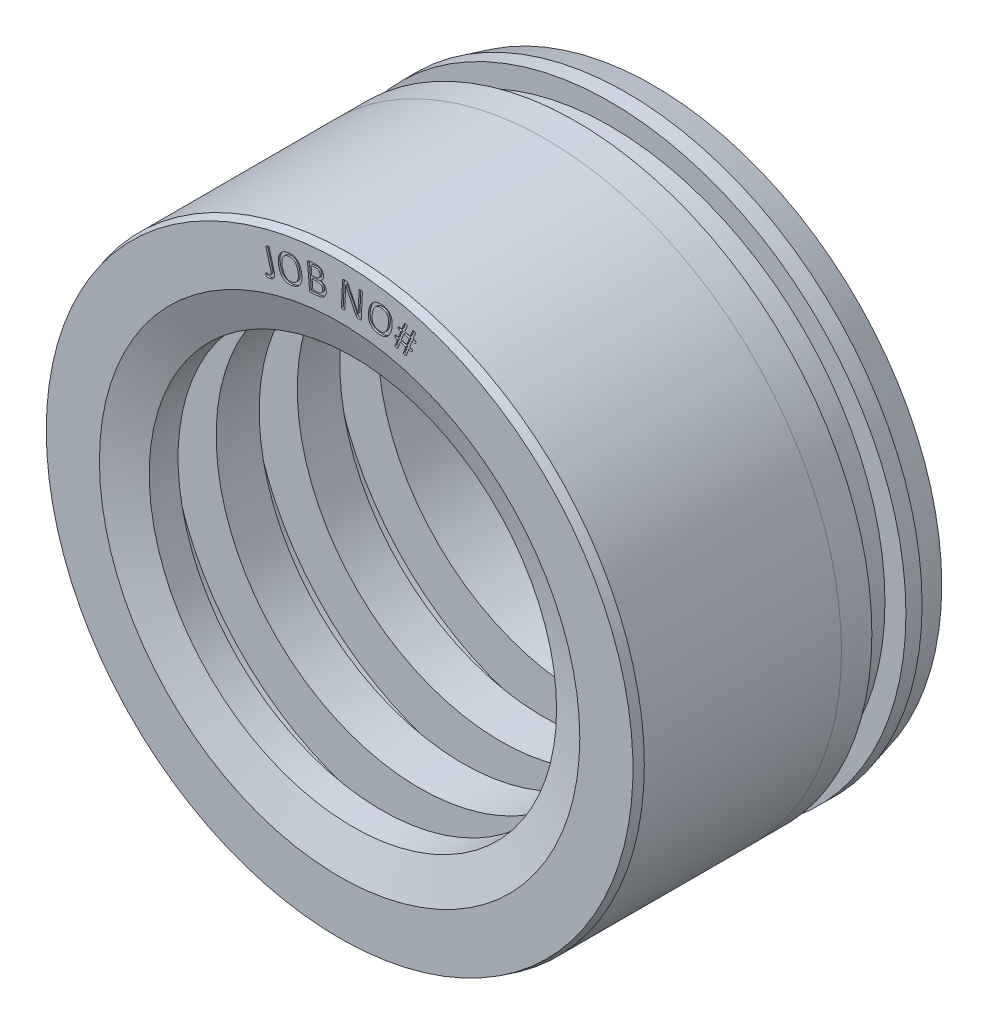
from build123d import *

# Parameters (mm, degrees)
CHAMFER1_SIZE      = 1
CHAMFER1_SIZE2     = 0.267949192
CUT_EXTRUDE1_DEPTH = 0.2


with BuildPart() as part:
    # Sketch1 → Revolve1 (revolve)
    with BuildSketch(Plane(origin=(0, 0, 0), x_dir=(0, 0, -1), z_dir=(1, 0, 0)), mode=Mode.PRIVATE) as revolve1_sk:
        Polygon((35, 32.186152423), (32, 32.99), (30.2, 32.99), (30.2, 30.65), (26.4, 30.65), (26.4, 32.99), (23, 32.99), (23, 33), (0, 33), (0, 26.8), (1.483178705, 22.725), (4.7, 22.725), (4.7, 27.95), (8.95, 27.95), (8.95, 22.725), (13.75, 22.725), (13.75, 27.95), (18, 27.95), (18, 22.725), (22.75, 22.725), (22.75, 27.95), (27, 27.95), (27, 22.725), (34, 22.725), (35, 24.457050808), align=None)
    revolve(revolve1_sk.sketch.rotate(Axis((0, 0, 0), (0, 0, -1)), 90), axis=Axis((0, 0, 0), (0, 0, -1)))

    # Chamfer1
    chamfer1_edges = [part.edges().sort_by_distance(p)[0] for p in [
        (-33, 0, 0),
    ]]
    chamfer1_side = [part.faces().sort_by_distance(p)[0] for p in [
        (-33, 0, -11.5),
    ]]
    chamfer(chamfer1_edges, length=CHAMFER1_SIZE, length2=CHAMFER1_SIZE2, reference=chamfer1_side[0])

    # Sketch2 → Cut-Extrude1 (cut)
    # profile 1 of 6: a face of its own
    with BuildSketch(Plane.XY):
        with BuildLine():
            add(Edge.make_bspline(
                [(8.501678764, 29.048994832), (8.498549681, 29.03756519), (8.492753583, 29.016393708), (8.481651699, 28.987903351), (8.46849952, 28.965577247), (8.4557374, 28.947427815), (8.440343664, 28.935703416), (8.424547967, 28.92855662), (8.40821196, 28.926457588), (8.397779108, 28.92835772), (8.392671889, 28.929287896)],
                knots=[0, 0, 0, 0, 1.577359455, 2.921792161, 4.051662468, 5.024971448, 5.849934203, 6.594100363, 7.31176662, 8, 8, 8, 8], degree=3))
            Line((8.392671889, 28.929287896), (8.105107743, 29.002850817))
            Line((8.105107743, 29.002850817), (7.831587426, 28.296646773))
            Line((7.831587426, 28.296646773), (8.085713882, 28.231777652))
            add(Edge.make_bspline(
                [(8.085713882, 28.231777652), (8.095930094, 28.227391442), (8.117305676, 28.218214087), (8.130661319, 28.189522189), (8.13712975, 28.162799785), (8.136032434, 28.136680174), (8.133021582, 28.10593828), (8.127508805, 28.084376252), (8.124501604, 28.07261424)],
                knots=[0, 0, 0, 0, 1.06858838, 2.235828552, 2.937870731, 3.799394226, 4.799577181, 6, 6, 6, 6], degree=3))
            add(Edge.make_bspline(
                [(8.124501604, 28.07261424), (8.121497998, 28.06113345), (8.115889821, 28.039697111), (8.103239283, 28.011727446), (8.089233167, 27.989754244), (8.076315896, 27.972338553), (8.062478156, 27.958672932), (8.046127569, 27.952389747), (8.029723415, 27.950033816), (8.019273026, 27.951962938), (8.014157222, 27.952907305)],
                knots=[0, 0, 0, 0, 1.574619005, 2.940047235, 4.05779653, 5.029414517, 5.826415199, 6.596542924, 7.312962333, 8, 8, 8, 8], degree=3))
            Line((8.014157222, 27.952907305), (7.722580552, 28.02713898))
            Line((7.722580552, 28.02713898), (7.439028928, 27.300203567))
            add(Edge.make_bspline(
                [(7.439028928, 27.300203567), (7.436951428, 27.295674235), (7.432755283, 27.286525873), (7.423803663, 27.274280204), (7.410295919, 27.265702561), (7.392878027, 27.260050843), (7.369846988, 27.260755812), (7.340701098, 27.262214235), (7.303753538, 27.270067393), (7.276494597, 27.276511289), (7.26114041, 27.280140952)],
                knots=[0, 0, 0, 0, 0.60656633, 1.225145041, 1.811980333, 2.524017901, 3.419602356, 4.588875977, 6.078610788, 8, 8, 8, 8], degree=3))
            add(Edge.make_bspline(
                [(7.26114041, 27.280140952), (7.245954002, 27.284265309), (7.218320155, 27.291770168), (7.181234682, 27.303440164), (7.15276853, 27.315417931), (7.131617946, 27.327120595), (7.118227123, 27.34021447), (7.110180644, 27.353916815), (7.109893726, 27.369027826), (7.113044146, 27.378303089), (7.114683321, 27.383129042)],
                knots=[0, 0, 0, 0, 1.874516537, 3.410951809, 4.62412259, 5.552976479, 6.266363648, 6.836406045, 7.394577765, 8, 8, 8, 8], degree=3))
            Line((7.114683321, 27.383129042), (7.397566191, 28.110064455))
            Line((7.397566191, 28.110064455), (6.787662698, 28.265884097))
            Line((6.787662698, 28.265884097), (6.504111074, 27.538948684))
            add(Edge.make_bspline(
                [(6.504111074, 27.538948684), (6.501470109, 27.534479476), (6.496315019, 27.525755708), (6.488164529, 27.513113498), (6.475662697, 27.503597411), (6.458590089, 27.498394105), (6.436270613, 27.497627899), (6.407608436, 27.500821519), (6.371040996, 27.507890683), (6.344023611, 27.5145109), (6.328897571, 27.518217316)],
                knots=[0, 0, 0, 0, 0.64064477, 1.250520422, 1.838348835, 2.533225652, 3.413898066, 4.572749697, 6.081208675, 8, 8, 8, 8], degree=3))
            add(Edge.make_bspline(
                [(6.328897571, 27.518217316), (6.313040308, 27.522319889), (6.284492246, 27.529705812), (6.246479161, 27.541380416), (6.217911333, 27.553562836), (6.196689586, 27.564961571), (6.183759178, 27.578605938), (6.175991434, 27.592502452), (6.17576988, 27.607669861), (6.178402652, 27.617029357), (6.179765467, 27.621874159)],
                knots=[0, 0, 0, 0, 1.927076015, 3.469343156, 4.667425873, 5.584727714, 6.270953198, 6.857235194, 7.408464998, 8, 8, 8, 8], degree=3))
            Line((6.179765467, 27.621874159), (6.460642076, 28.348809572))
            Line((6.460642076, 28.348809572), (6.20651562, 28.413678694))
            add(Edge.make_bspline(
                [(6.20651562, 28.413678694), (6.196415693, 28.418118016), (6.175358749, 28.427373386), (6.160334905, 28.455120116), (6.155418807, 28.482115409), (6.156068966, 28.508084226), (6.159317598, 28.538571375), (6.164344583, 28.559956613), (6.167059144, 28.571504597)],
                knots=[0, 0, 0, 0, 1.075545008, 2.242361686, 2.944412003, 3.81154411, 4.818238366, 6, 6, 6, 6], degree=3))
            add(Edge.make_bspline(
                [(6.167059144, 28.571504597), (6.170328125, 28.582975601), (6.176416376, 28.604339554), (6.189163334, 28.632509153), (6.202693703, 28.654600092), (6.215395701, 28.672127455), (6.229019854, 28.684899038), (6.244300738, 28.69263808), (6.261136058, 28.695534969), (6.272291292, 28.693568253), (6.27807228, 28.692549041)],
                knots=[0, 0, 0, 0, 1.574723399, 2.932813638, 4.069646214, 4.99474395, 5.787461446, 6.512109029, 7.228928864, 8, 8, 8, 8], degree=3))
            Line((6.27807228, 28.692549041), (6.571655211, 28.617648612))
            Line((6.571655211, 28.617648612), (6.847850543, 29.323183902))
            Line((6.847850543, 29.323183902), (6.582355273, 29.390728039))
            add(Edge.make_bspline(
                [(6.582355273, 29.390728039), (6.572457875, 29.395199612), (6.551448372, 29.404691555), (6.537185229, 29.432998777), (6.531042469, 29.459972124), (6.532139948, 29.485553825), (6.534224325, 29.51500743), (6.539414638, 29.535455786), (6.542230043, 29.546547681)],
                knots=[0, 0, 0, 0, 1.07166923, 2.274864503, 3.013780115, 3.870973041, 4.845142253, 6, 6, 6, 6], degree=3))
            add(Edge.make_bspline(
                [(6.542230043, 29.546547681), (6.54527547, 29.558463042), (6.550949315, 29.580662205), (6.563062371, 29.609840067), (6.575542575, 29.633510844), (6.593315921, 29.654691498), (6.619210274, 29.673557515), (6.642279558, 29.67087381), (6.653243178, 29.669598386)],
                knots=[0, 0, 0, 0, 1.200825084, 2.237222169, 3.086333729, 3.798121571, 4.953562727, 6, 6, 6, 6], degree=3))
            Line((6.653243178, 29.669598386), (6.951507387, 29.593360449))
            Line((6.951507387, 29.593360449), (7.22101518, 30.274820602))
            add(Edge.make_bspline(
                [(7.22101518, 30.274820602), (7.223320091, 30.279357896), (7.227848855, 30.288272922), (7.237515083, 30.300679834), (7.252132102, 30.309404688), (7.271573618, 30.313863847), (7.295945177, 30.314745171), (7.326854445, 30.312443317), (7.365322887, 30.306182184), (7.393379514, 30.299343536), (7.408935006, 30.29555197)],
                knots=[0, 0, 0, 0, 0.592664552, 1.164486684, 1.805777482, 2.530013117, 3.466198308, 4.637221686, 6.135568013, 8, 8, 8, 8], degree=3))
            add(Edge.make_bspline(
                [(7.408935006, 30.29555197), (7.424627817, 30.291364131), (7.452254409, 30.283991602), (7.488040635, 30.270790032), (7.514914999, 30.259182603), (7.533578946, 30.246946224), (7.546690912, 30.234765329), (7.551500447, 30.220302634), (7.551049204, 30.206724427), (7.549475885, 30.198119839), (7.548704556, 30.193901388)],
                knots=[0, 0, 0, 0, 2.016994508, 3.550841433, 4.740890769, 5.639934809, 6.325892007, 6.912962093, 7.467073099, 8, 8, 8, 8], degree=3))
            Line((7.548704556, 30.193901388), (7.276521748, 29.511103728))
            Line((7.276521748, 29.511103728), (7.88642524, 29.355284086))
            Line((7.88642524, 29.355284086), (8.151251757, 30.037412992))
            add(Edge.make_bspline(
                [(8.151251757, 30.037412992), (8.153448519, 30.042250371), (8.157808562, 30.051851403), (8.168978515, 30.063594721), (8.183650434, 30.07177528), (8.202446401, 30.076547172), (8.226415563, 30.077305405), (8.257299295, 30.074984701), (8.296515804, 30.068850127), (8.325189321, 30.061547561), (8.341177845, 30.057475607)],
                knots=[0, 0, 0, 0, 0.609823913, 1.210353685, 1.832531076, 2.525167451, 3.426971609, 4.587115257, 6.096955182, 8, 8, 8, 8], degree=3))
            add(Edge.make_bspline(
                [(8.341177845, 30.057475607), (8.356654441, 30.05353307), (8.384306495, 30.046488934), (8.420218788, 30.033261108), (8.447552053, 30.022110608), (8.465957385, 30.009586094), (8.478254561, 29.997129812), (8.482945879, 29.983152115), (8.482917259, 29.969599589), (8.480281216, 29.961354222), (8.478941133, 29.957162532)],
                knots=[0, 0, 0, 0, 1.993008847, 3.560911412, 4.782407199, 5.663029014, 6.333690607, 6.923772937, 7.452879369, 8, 8, 8, 8], degree=3))
            Line((8.478941133, 29.957162532), (8.211439602, 29.272358611))
            Line((8.211439602, 29.272358611), (8.463559795, 29.208158243))
            add(Edge.make_bspline(
                [(8.463559795, 29.208158243), (8.473512171, 29.2037308), (8.494900413, 29.194215963), (8.508257373, 29.164807885), (8.513072196, 29.137516325), (8.513800437, 29.11147173), (8.509122582, 29.081529942), (8.504272292, 29.060330508), (8.501678764, 29.048994832)],
                knots=[0, 0, 0, 0, 1.054796918, 2.266820877, 2.989683893, 3.833673301, 4.841630449, 6, 6, 6, 6], degree=3))
        make_face()
        Polygon((7.170189889, 29.240927181), (6.896669572, 28.534723137), (7.504566804, 28.380241002), (7.782768397, 29.084438785), align=None, mode=Mode.SUBTRACT)
    # profile 2 of 6: a face of its own
    with BuildSketch(Plane.XY):
        with BuildLine():
            add(Edge.make_bspline(
                [(5.841344359, 29.172417648), (5.831674817, 29.11541034), (5.812806858, 29.004173259), (5.771598091, 28.843736559), (5.721496573, 28.693560046), (5.66296085, 28.553578904), (5.595590241, 28.424616276), (5.519073802, 28.307804093), (5.434607113, 28.202299945), (5.340639543, 28.109791646), (5.238280319, 28.029447964), (5.127142548, 27.961775055), (5.006614972, 27.908695236), (4.87818745, 27.867083659), (4.740870929, 27.84165741), (4.595490137, 27.829516327), (4.441732459, 27.832992103), (4.337446996, 27.846624459), (4.283816689, 27.853635096)],
                knots=[0, 0, 0, 0, 1.195743236, 2.33322698, 3.422569482, 4.468326068, 5.468769389, 6.428052817, 7.352796333, 8.259331163, 9.149544344, 10.039279623, 10.943430267, 11.868058793, 12.825844666, 13.825384172, 14.881672389, 16, 16, 16, 16], degree=3))
            add(Edge.make_bspline(
                [(4.283816689, 27.853635096), (4.231235263, 27.862984545), (4.129579992, 27.881059764), (3.984876941, 27.922116842), (3.852921301, 27.97337405), (3.733745028, 28.035697762), (3.627563114, 28.108234291), (3.533239126, 28.189918615), (3.451466678, 28.28129781), (3.38099806, 28.381893592), (3.323242452, 28.4925462), (3.277983898, 28.613062625), (3.244013681, 28.742839186), (3.221255065, 28.881865962), (3.211335881, 29.030245132), (3.211371437, 29.187315937), (3.22294893, 29.353294018), (3.238544914, 29.466078809), (3.2465795, 29.524182162)],
                knots=[0, 0, 0, 0, 1.137963347, 2.200015881, 3.200748308, 4.150928942, 5.060427983, 5.936202435, 6.804440474, 7.667944661, 8.547963664, 9.457921957, 10.406580246, 11.403468906, 12.456456176, 13.573225575, 14.749798351, 16, 16, 16, 16], degree=3))
            add(Edge.make_bspline(
                [(3.2465795, 29.524182162), (3.256059736, 29.579844054), (3.274620552, 29.688821303), (3.314939226, 29.846199501), (3.364608748, 29.993826692), (3.422219342, 30.132050366), (3.490060225, 30.259127322), (3.565131518, 30.375829516), (3.650777889, 30.479377362), (3.74484371, 30.571023958), (3.847678025, 30.650500415), (3.959218134, 30.717072314), (4.07964144, 30.770229176), (4.20835037, 30.810477763), (4.345905265, 30.836298943), (4.491563053, 30.848536076), (4.645508757, 30.843985028), (4.749805195, 30.830503547), (4.803438415, 30.823570853)],
                knots=[0, 0, 0, 0, 1.175170615, 2.30079967, 3.378038498, 4.415856125, 5.4144974, 6.373496265, 7.299902016, 8.205747275, 9.10247536, 9.999491635, 10.903301592, 11.836875559, 12.800791796, 13.811353984, 14.874514468, 16, 16, 16, 16], degree=3))
            add(Edge.make_bspline(
                [(4.803438415, 30.823570853), (4.854897698, 30.814410743), (4.95473482, 30.796639042), (5.097022828, 30.756434434), (5.227202099, 30.70578327), (5.344805172, 30.643718407), (5.451464177, 30.572946673), (5.545695329, 30.491474237), (5.627983906, 30.40039895), (5.698633993, 30.299982038), (5.757842044, 30.190291412), (5.804742684, 30.071031082), (5.839236726, 29.942427016), (5.862468992, 29.804931294), (5.873960527, 29.658614388), (5.875393776, 29.503730259), (5.864349453, 29.340411378), (5.849148526, 29.229407252), (5.841344359, 29.172417648)],
                knots=[0, 0, 0, 0, 1.125000981, 2.182635575, 3.178335119, 4.12739835, 5.040716637, 5.928978647, 6.802434381, 7.677432056, 8.566627468, 9.480311514, 10.430539449, 11.428839112, 12.478864411, 13.587773965, 14.761561271, 16, 16, 16, 16], degree=3))
        make_face()
        with BuildLine():
            add(Edge.make_bspline(
                [(5.432735769, 29.207861601), (5.438473139, 29.248162371), (5.449792341, 29.327671378), (5.45979742, 29.445534151), (5.463133395, 29.560065973), (5.46059977, 29.670582374), (5.45205249, 29.776936655), (5.433752844, 29.877600934), (5.407994191, 29.972540537), (5.37294401, 30.061294895), (5.329793066, 30.144302912), (5.275693283, 30.21985124), (5.211528559, 30.287909574), (5.13728177, 30.348583973), (5.052308577, 30.401232475), (4.955490203, 30.443916097), (4.847093042, 30.477600543), (4.769972778, 30.491387969), (4.729875494, 30.498556492)],
                knots=[0, 0, 0, 0, 1.163836678, 2.296122301, 3.380212619, 4.438644511, 5.456070731, 6.427573492, 7.360088784, 8.264423273, 9.151199722, 10.028533044, 10.912372227, 11.818322723, 12.762916217, 13.761559305, 14.836163322, 16, 16, 16, 16], degree=3))
            add(Edge.make_bspline(
                [(4.729875494, 30.498556492), (4.689596386, 30.503757017), (4.611913465, 30.513786832), (4.49830637, 30.512716337), (4.392385317, 30.500282835), (4.295043138, 30.472184574), (4.205310417, 30.43357901), (4.122395239, 30.386140853), (4.047088372, 30.328365859), (3.977929153, 30.26294223), (3.916239618, 30.188414561), (3.860451767, 30.106603415), (3.811763585, 30.016612749), (3.769853436, 29.919509508), (3.734582739, 29.816758743), (3.702667533, 29.710539917), (3.677384334, 29.600304585), (3.664426629, 29.525361805), (3.657863105, 29.487400701)],
                knots=[0, 0, 0, 0, 1.164650783, 2.246163807, 3.252636931, 4.216927154, 5.142914483, 6.051760683, 6.951527136, 7.861341595, 8.779021547, 9.723292396, 10.699799861, 11.711508199, 12.755842007, 13.816865051, 14.894166811, 16, 16, 16, 16], degree=3))
            add(Edge.make_bspline(
                [(3.657863105, 29.487400701), (3.651897883, 29.44576292), (3.640187437, 29.364022957), (3.629619279, 29.242814662), (3.624843149, 29.125651863), (3.625782584, 29.013099407), (3.633932807, 28.905662153), (3.651461688, 28.804307784), (3.676698988, 28.708783855), (3.71045329, 28.619365687), (3.754492516, 28.53706604), (3.807215449, 28.46135401), (3.871321476, 28.394062792), (3.944482242, 28.333038201), (4.029838237, 28.281196206), (4.127434827, 28.239332754), (4.236827176, 28.205603507), (4.314829109, 28.191828358), (4.355373349, 28.184668241)],
                knots=[0, 0, 0, 0, 1.192429185, 2.340881595, 3.447835165, 4.516056661, 5.530652277, 6.499076176, 7.428152696, 8.328448492, 9.202150189, 10.068413255, 10.935851447, 11.82926556, 12.762567663, 13.755996192, 14.833600316, 16, 16, 16, 16], degree=3))
            add(Edge.make_bspline(
                [(4.355373349, 28.184668241), (4.396093248, 28.179581348), (4.474438128, 28.169794192), (4.589252805, 28.169313351), (4.695776467, 28.183430599), (4.794501859, 28.209918476), (4.884420432, 28.249883812), (4.968329919, 28.297033118), (5.044345987, 28.3551471), (5.112787284, 28.422897404), (5.175051969, 28.498314514), (5.229785093, 28.582149076), (5.279082413, 28.672425375), (5.31984036, 28.77060954), (5.355593476, 28.8739707), (5.387011433, 28.981504581), (5.413511228, 29.093062845), (5.426263318, 29.169211557), (5.432735769, 29.207861601)],
                knots=[0, 0, 0, 0, 1.166421397, 2.244188845, 3.254687502, 4.214409718, 5.140108605, 6.045991596, 6.946266729, 7.851861275, 8.779685267, 9.72216556, 10.695155783, 11.700770128, 12.741368152, 13.804680867, 14.885743708, 16, 16, 16, 16], degree=3))
        make_face(mode=Mode.SUBTRACT)
    # profile 3 of 6: a face of its own
    with BuildSketch(Plane.XY):
        with BuildLine():
            add(Edge.make_bspline(
                [(2.414900928, 28.303990182), (2.413795537, 28.290034958), (2.41171121, 28.263720976), (2.398449602, 28.228300424), (2.380217559, 28.199213139), (2.35689424, 28.177230168), (2.331166837, 28.159643158), (2.30231518, 28.149507265), (2.272687252, 28.143860563), (2.252863674, 28.144059396), (2.243031194, 28.144158017)],
                knots=[0, 0, 0, 0, 1.265186763, 2.385637074, 3.396142155, 4.355069128, 5.275640801, 6.204186777, 7.109278014, 8, 8, 8, 8], degree=3))
            Line((2.243031194, 28.144158017), (2.118642982, 28.150176802))
            add(Edge.make_bspline(
                [(2.118642982, 28.150176802), (2.100316568, 28.15148309), (2.065750747, 28.153946907), (2.016392722, 28.164894529), (1.972663254, 28.186104876), (1.931991954, 28.21645517), (1.894619387, 28.258710724), (1.857121876, 28.312402051), (1.819642553, 28.380386257), (1.794131203, 28.430527655), (1.780253544, 28.457803563)],
                knots=[0, 0, 0, 0, 0.903598151, 1.704294819, 2.469581762, 3.276786746, 4.184965821, 5.231708104, 6.494105142, 8, 8, 8, 8], degree=3))
            Line((1.780253544, 28.457803563), (0.937623718, 30.162457075))
            add(Edge.make_bspline(
                [(0.937623718, 30.162457075), (0.915465003, 30.207665845), (0.870397672, 30.299613349), (0.804090192, 30.439142736), (0.740470757, 30.579707408), (0.700900517, 30.673964111), (0.681491002, 30.720197769)],
                knots=[0, 0, 0, 0, 0.98420471, 2.001717047, 3.019826417, 4, 4, 4, 4], degree=3))
            Line((0.681491002, 30.720197769), (0.676809725, 30.720197769))
            add(Edge.make_bspline(
                [(0.676809725, 30.720197769), (0.675570273, 30.66535724), (0.673065911, 30.554549768), (0.667481392, 30.387595202), (0.661614041, 30.219731552), (0.657025944, 30.107840073), (0.654740848, 30.052112693)],
                knots=[0, 0, 0, 0, 0.984724736, 1.989675538, 2.998760977, 4, 4, 4, 4], degree=3))
            Line((0.654740848, 30.052112693), (0.57114662, 28.289277598))
            add(Edge.make_bspline(
                [(0.57114662, 28.289277598), (0.570562597, 28.28407016), (0.569329582, 28.27307599), (0.561143372, 28.257888213), (0.547502453, 28.244915271), (0.527632687, 28.236600857), (0.502049989, 28.231030572), (0.469666801, 28.226173862), (0.428930915, 28.22456429), (0.399050574, 28.225325714), (0.38255804, 28.225745984)],
                knots=[0, 0, 0, 0, 0.571139017, 1.205813606, 1.846121513, 2.601370287, 3.532966211, 4.719703372, 6.189431547, 8, 8, 8, 8], degree=3))
            add(Edge.make_bspline(
                [(0.38255804, 28.225745984), (0.366048369, 28.226594579), (0.336253607, 28.228126027), (0.296058713, 28.233723396), (0.264964671, 28.242618455), (0.240039473, 28.249358908), (0.222038468, 28.260655243), (0.210042826, 28.27440301), (0.20374112, 28.290338375), (0.203467231, 28.301268857), (0.203332013, 28.306665198)],
                knots=[0, 0, 0, 0, 1.831044974, 3.304460178, 4.478093438, 5.414920516, 6.147687922, 6.795707012, 7.405444794, 8, 8, 8, 8], degree=3))
            Line((0.203332013, 28.306665198), (0.330395241, 31.001743131))
            add(Edge.make_bspline(
                [(0.330395241, 31.001743131), (0.331748841, 31.015622894), (0.334301191, 31.041794586), (0.344344547, 31.077744717), (0.361814328, 31.106794174), (0.384980711, 31.12823982), (0.411425557, 31.143406315), (0.438937981, 31.154139783), (0.467403227, 31.1607481), (0.486627534, 31.160407969), (0.496246191, 31.160237789)],
                knots=[0, 0, 0, 0, 1.289476452, 2.431437729, 3.421963524, 4.385048005, 5.318975301, 6.226797814, 7.112799041, 8, 8, 8, 8], degree=3))
            Line((0.496246191, 31.160237789), (0.681491002, 31.151543989))
            add(Edge.make_bspline(
                [(0.681491002, 31.151543989), (0.701393286, 31.150287783), (0.737940311, 31.147980984), (0.788485423, 31.137229228), (0.831680629, 31.120453497), (0.869147649, 31.095020937), (0.903397, 31.061475518), (0.933792651, 31.016656375), (0.966474129, 30.962564493), (0.9867685, 30.921674076), (0.997811563, 30.899423795)],
                knots=[0, 0, 0, 0, 1.100944121, 2.021689197, 2.845320784, 3.644919334, 4.507441307, 5.478495661, 6.627938179, 8, 8, 8, 8], degree=3))
            Line((0.997811563, 30.899423795), (1.645834024, 29.583985012))
            add(Edge.make_bspline(
                [(1.645834024, 29.583985012), (1.665497365, 29.544328416), (1.704337516, 29.46599645), (1.761061124, 29.349574166), (1.816324637, 29.235967395), (1.868192966, 29.12360608), (1.919853786, 29.013666566), (1.96989233, 28.904621152), (2.02073315, 28.797025199), (2.053012214, 28.724695979), (2.069155198, 28.688523634)],
                knots=[0, 0, 0, 0, 1.072469424, 2.118402676, 3.137824405, 4.133343272, 5.116789259, 6.080988452, 7.040289005, 8, 8, 8, 8], degree=3))
            Line((2.069155198, 28.688523634), (2.07116146, 28.688523634))
            add(Edge.make_bspline(
                [(2.07116146, 28.688523634), (2.072872557, 28.749382445), (2.076357776, 28.873341614), (2.082974619, 29.060376897), (2.090918271, 29.24718016), (2.096957662, 29.370878371), (2.099917874, 29.431509139)],
                knots=[0, 0, 0, 0, 0.982560878, 2.001311366, 3.020341313, 4, 4, 4, 4], degree=3))
            Line((2.099917874, 29.431509139), (2.174818303, 31.015786962))
            add(Edge.make_bspline(
                [(2.174818303, 31.015786962), (2.175347895, 31.021016606), (2.176395287, 31.031359451), (2.184693626, 31.045680129), (2.198058672, 31.05806589), (2.217737047, 31.067874073), (2.243339265, 31.076069194), (2.276622491, 31.07921732), (2.317923587, 31.080523288), (2.348469441, 31.079318252), (2.365413145, 31.078649822)],
                knots=[0, 0, 0, 0, 0.566992692, 1.121360588, 1.757020021, 2.528500237, 3.496342225, 4.671204987, 6.153526286, 8, 8, 8, 8], degree=3))
            add(Edge.make_bspline(
                [(2.365413145, 31.078649822), (2.381050312, 31.078063081), (2.409745355, 31.07698638), (2.448963343, 31.07123807), (2.481115477, 31.065090735), (2.505237267, 31.054339162), (2.523883103, 31.043632859), (2.534814598, 31.029045363), (2.542442893, 31.014287908), (2.542570543, 31.003614279), (2.54263291, 30.998399362)],
                knots=[0, 0, 0, 0, 1.753313401, 3.217424463, 4.448853774, 5.40107447, 6.177888877, 6.818368821, 7.42267918, 8, 8, 8, 8], degree=3))
            Line((2.54263291, 30.998399362), (2.414900928, 28.303990182))
        make_face()
    # profile 4 of 6: a face of its own
    with BuildSketch(Plane.XY):
        with BuildLine():
            add(Edge.make_bspline(
                [(-1.487794365, 29.058806283), (-1.486047106, 29.0363036), (-1.482607117, 28.992000517), (-1.4845593, 28.926509501), (-1.489503486, 28.863220125), (-1.502888574, 28.783289793), (-1.529147249, 28.688422057), (-1.577643909, 28.584036677), (-1.641037859, 28.49028893), (-1.717714407, 28.406910845), (-1.808090448, 28.334295731), (-1.909599005, 28.271551039), (-2.022161725, 28.220311634), (-2.122615064, 28.186338038), (-2.20874656, 28.16500776), (-2.278942275, 28.152080066), (-2.354040982, 28.140326639), (-2.405960583, 28.135217698), (-2.432743527, 28.132582229)],
                knots=[0, 0, 0, 0, 0.724669626, 1.426723118, 2.102415013, 2.762981286, 4.02818029, 5.252266629, 6.444163582, 7.65058401, 8.877684004, 10.157716993, 11.474844036, 12.842865861, 13.558560463, 14.324125006, 15.135492872, 16, 16, 16, 16], degree=3))
            Line((-2.432743527, 28.132582229), (-3.195122892, 28.0663756))
            add(Edge.make_bspline(
                [(-3.195122892, 28.0663756), (-3.212472753, 28.066562475), (-3.248229548, 28.066947612), (-3.290844401, 28.086147335), (-3.320370686, 28.111195679), (-3.337422482, 28.138719614), (-3.348446406, 28.172896648), (-3.351814632, 28.198037809), (-3.35361755, 28.211495181)],
                knots=[0, 0, 0, 0, 1.276347192, 2.630458209, 3.356467633, 4.122026272, 4.994772259, 6, 6, 6, 6], degree=3))
            Line((-3.35361755, 28.211495181), (-3.580993852, 30.816291348))
            add(Edge.make_bspline(
                [(-3.580993852, 30.816291348), (-3.58164471, 30.829886478), (-3.582867397, 30.855425973), (-3.578240519, 30.891190516), (-3.565737645, 30.920933815), (-3.541587914, 30.9507348), (-3.502654237, 30.976408429), (-3.467655282, 30.983409342), (-3.450586855, 30.986823574)],
                knots=[0, 0, 0, 0, 1.008727652, 1.894972156, 2.650500895, 3.368363646, 4.716593403, 6, 6, 6, 6], degree=3))
            Line((-3.450586855, 30.986823574), (-2.787183056, 31.044336404))
            add(Edge.make_bspline(
                [(-2.787183056, 31.044336404), (-2.74552253, 31.047524334), (-2.666065883, 31.053604483), (-2.551906247, 31.054295854), (-2.449003482, 31.048249178), (-2.356369441, 31.034070711), (-2.272709529, 31.013222994), (-2.196063317, 30.986528211), (-2.125797384, 30.95389114), (-2.062506876, 30.913978531), (-2.005287605, 30.868241294), (-1.954018442, 30.816806055), (-1.910328591, 30.758391017), (-1.872954266, 30.69457117), (-1.841218945, 30.625734714), (-1.817459712, 30.551063396), (-1.798868446, 30.471730927), (-1.793042437, 30.416471781), (-1.790071096, 30.388288897)],
                knots=[0, 0, 0, 0, 1.471836611, 2.807146509, 4.019306775, 5.100196088, 6.104145403, 7.053093721, 7.95610272, 8.827824916, 9.682825641, 10.532615105, 11.379349855, 12.245534095, 13.134808447, 14.043911681, 15.00236945, 16, 16, 16, 16], degree=3))
            add(Edge.make_bspline(
                [(-1.790071096, 30.388288897), (-1.788190758, 30.354167415), (-1.784481557, 30.286858553), (-1.796051224, 30.187690142), (-1.818341096, 30.093253173), (-1.853923659, 30.004932884), (-1.902843132, 29.923412863), (-1.964622176, 29.849903981), (-2.038408411, 29.784549525), (-2.095504826, 29.751168888), (-2.124448011, 29.734247651)],
                knots=[0, 0, 0, 0, 1.049435083, 2.070141058, 3.057983337, 4.026941022, 4.986488524, 5.969751251, 6.970830905, 8, 8, 8, 8], degree=3))
            add(Edge.make_bspline(
                [(-2.124448011, 29.734247651), (-2.104332118, 29.731682835), (-2.064468605, 29.726600159), (-2.005747392, 29.713119726), (-1.948997253, 29.693967456), (-1.893471613, 29.671665093), (-1.840410703, 29.644096111), (-1.790317804, 29.611754289), (-1.742428871, 29.57583369), (-1.698458373, 29.53450667), (-1.656559316, 29.489972475), (-1.619308017, 29.440190606), (-1.585516781, 29.386392913), (-1.5563521, 29.328038695), (-1.530731213, 29.266070153), (-1.510816432, 29.200206308), (-1.495760658, 29.130883211), (-1.49048714, 29.0831698), (-1.487794365, 29.058806283)],
                knots=[0, 0, 0, 0, 0.963152897, 1.908672752, 2.856562631, 3.806580477, 4.749307939, 5.692451813, 6.6372595, 7.589164879, 8.556037874, 9.538963708, 10.538189747, 11.570819894, 12.634911154, 13.720451816, 14.836012618, 16, 16, 16, 16], degree=3))
        make_face()
        with BuildLine():
            add(Edge.make_bspline(
                [(-2.186642117, 30.314725975), (-2.190795348, 30.348409246), (-2.198787359, 30.413225546), (-2.224894202, 30.489372509), (-2.25179713, 30.543870049), (-2.276972046, 30.579771808), (-2.304885039, 30.613063984), (-2.337601866, 30.6418733), (-2.373995017, 30.667926113), (-2.415662718, 30.688900691), (-2.461570295, 30.706491519), (-2.512462894, 30.719773755), (-2.569259949, 30.729471022), (-2.633545411, 30.732579229), (-2.705473963, 30.733070364), (-2.755990918, 30.728878296), (-2.78250178, 30.726678334)],
                knots=[0, 0, 0, 0, 1.70575678, 3.282366563, 4.025596967, 4.760639134, 5.485315911, 6.208947982, 6.950394937, 7.733846453, 8.55132201, 9.422918287, 10.379155716, 11.448025761, 12.660745919, 14, 14, 14, 14], degree=3))
            Line((-2.78250178, 30.726678334), (-3.184422831, 30.691903135))
            Line((-3.184422831, 30.691903135), (-3.101497356, 29.74628522))
            Line((-3.101497356, 29.74628522), (-2.658782321, 29.785072942))
            add(Edge.make_bspline(
                [(-2.658782321, 29.785072942), (-2.63486676, 29.787536978), (-2.589193542, 29.792242719), (-2.524999277, 29.805734173), (-2.468367091, 29.822720824), (-2.419066222, 29.844546768), (-2.376168719, 29.870286364), (-2.337472227, 29.898535896), (-2.30335516, 29.929934466), (-2.273511779, 29.964488684), (-2.248208816, 30.001784063), (-2.227335802, 30.041788543), (-2.2103102, 30.084039579), (-2.194985828, 30.143837097), (-2.182935268, 30.221108806), (-2.185404846, 30.283478454), (-2.186642117, 30.314725975)],
                knots=[0, 0, 0, 0, 1.251837969, 2.390722413, 3.411963682, 4.327042048, 5.191486947, 6.013788832, 6.819269223, 7.601557502, 8.387544158, 9.161598963, 9.948785991, 10.754517532, 12.37399623, 14, 14, 14, 14], degree=3))
        make_face(mode=Mode.SUBTRACT)
        with BuildLine():
            add(Edge.make_bspline(
                [(-1.894396694, 29.0006247), (-1.896625661, 29.021870533), (-1.900955317, 29.063139483), (-1.914639121, 29.122219215), (-1.932723299, 29.176871491), (-1.955262434, 29.227301495), (-1.983167076, 29.272928946), (-2.014382891, 29.315186484), (-2.0517893, 29.351707726), (-2.092621302, 29.385007428), (-2.138415075, 29.412994841), (-2.188684229, 29.43657644), (-2.243441981, 29.456156792), (-2.303898954, 29.469756379), (-2.369981866, 29.480162583), (-2.443160746, 29.484397682), (-2.523563971, 29.483549502), (-2.57943864, 29.479540405), (-2.608625784, 29.477446181)],
                knots=[0, 0, 0, 0, 1.044520286, 2.028927471, 2.960291921, 3.858553377, 4.724714003, 5.573388652, 6.421852965, 7.275351058, 8.147194181, 9.04014122, 9.988909941, 10.986405508, 12.067865755, 13.259316558, 14.56835445, 16, 16, 16, 16], degree=3))
            Line((-2.608625784, 29.477446181), (-3.074078449, 29.436652197))
            Line((-3.074078449, 29.436652197), (-2.984465436, 28.407440053))
            Line((-2.984465436, 28.407440053), (-2.420037204, 28.456927837))
            add(Edge.make_bspline(
                [(-2.420037204, 28.456927837), (-2.39858719, 28.459023971), (-2.357023313, 28.463085669), (-2.29721813, 28.474858454), (-2.241878504, 28.489151231), (-2.175034864, 28.51312072), (-2.099703624, 28.552649634), (-2.03394994, 28.604466933), (-1.990064245, 28.653041246), (-1.960845824, 28.692639354), (-1.937038596, 28.736217376), (-1.917483621, 28.782795578), (-1.902310978, 28.832659214), (-1.894275194, 28.885983354), (-1.890404143, 28.942438957), (-1.893035597, 28.980788647), (-1.894396694, 29.0006247)],
                knots=[0, 0, 0, 0, 1.058371622, 2.050815794, 2.991311083, 3.86439927, 5.535087331, 7.148161259, 7.946832116, 8.746478746, 9.560326897, 10.380123396, 11.22570911, 12.113445736, 13.024195768, 14, 14, 14, 14], degree=3))
        make_face(mode=Mode.SUBTRACT)
    # profile 5 of 6: a face of its own
    with BuildSketch(Plane.XY):
        with BuildLine():
            add(Edge.make_bspline(
                [(-4.248976701, 29.440591696), (-4.238965051, 29.383868334), (-4.219418127, 29.273120629), (-4.205361294, 29.108503385), (-4.201354688, 28.950751344), (-4.209903004, 28.799738599), (-4.230357087, 28.656453459), (-4.262882334, 28.520943742), (-4.308684877, 28.394264646), (-4.365346576, 28.27570756), (-4.434934283, 28.166378469), (-4.516703821, 28.066052901), (-4.612298084, 27.976006054), (-4.71942377, 27.894845502), (-4.839375589, 27.824148244), (-4.972413, 27.765574146), (-5.117591961, 27.716823534), (-5.220180535, 27.695426927), (-5.272838815, 27.684444139)],
                knots=[0, 0, 0, 0, 1.195383738, 2.333888578, 3.426421027, 4.46953341, 5.470335521, 6.427875521, 7.357526121, 8.262137944, 9.150645892, 10.041946156, 10.942237846, 11.870689461, 12.827188625, 13.825805109, 14.883994995, 16, 16, 16, 16], degree=3))
            add(Edge.make_bspline(
                [(-5.272838815, 27.684444139), (-5.325109927, 27.675785775), (-5.426552704, 27.658982449), (-5.575884196, 27.648620712), (-5.716822145, 27.653122332), (-5.849333742, 27.67131332), (-5.973093042, 27.704785753), (-6.089254742, 27.749054762), (-6.196407567, 27.808348929), (-6.29629674, 27.879209386), (-6.386864271, 27.964797363), (-6.470251883, 28.062178262), (-6.545111215, 28.172881603), (-6.61285022, 28.295703165), (-6.671887007, 28.431427623), (-6.724099417, 28.57886481), (-6.76806495, 28.738585028), (-6.791092763, 28.849715641), (-6.802947577, 28.90692614)],
                knots=[0, 0, 0, 0, 1.133500525, 2.199789422, 3.197442372, 4.146732485, 5.05515039, 5.935783356, 6.800467389, 7.668959753, 8.549954482, 9.460174557, 10.407628714, 11.404825281, 12.457915736, 13.571502972, 14.749799695, 16, 16, 16, 16], degree=3))
            add(Edge.make_bspline(
                [(-6.802947577, 28.90692614), (-6.812375915, 28.96232785), (-6.830857246, 29.070925706), (-6.845554664, 29.232082814), (-6.848221911, 29.387405107), (-6.840337265, 29.536486273), (-6.818581209, 29.678513703), (-6.786484621, 29.813002375), (-6.740732151, 29.938778827), (-6.682746358, 30.055974883), (-6.613473078, 30.165089977), (-6.530006468, 30.263885562), (-6.435240401, 30.354234179), (-6.327475351, 30.434755516), (-6.207026521, 30.505158052), (-6.074143359, 30.564654543), (-5.92836, 30.612476431), (-5.825918321, 30.634383709), (-5.773066679, 30.645686097)],
                knots=[0, 0, 0, 0, 1.174020424, 2.301302612, 3.377496822, 4.418028101, 5.416742646, 6.375925972, 7.302804402, 8.206917809, 9.103657263, 9.996492508, 10.90258372, 11.834213937, 12.800889719, 13.812094822, 14.871217437, 16, 16, 16, 16], degree=3))
            add(Edge.make_bspline(
                [(-5.773066679, 30.645686097), (-5.721685233, 30.654144461), (-5.622012357, 30.670552514), (-5.475131425, 30.679985925), (-5.336197854, 30.675745817), (-5.205147842, 30.657219118), (-5.081990667, 30.624647536), (-4.965946529, 30.580881693), (-4.858258607, 30.522760012), (-4.758460292, 30.451849481), (-4.666607972, 30.368416851), (-4.582234946, 30.272604022), (-4.506697068, 30.163520048), (-4.439423842, 30.041772545), (-4.379120311, 29.908305742), (-4.327369521, 29.762807974), (-4.283080232, 29.605911511), (-4.260552153, 29.496704701), (-4.248976701, 29.440591696)],
                knots=[0, 0, 0, 0, 1.1251043, 2.182546217, 3.175764308, 4.125041477, 5.036686699, 5.924420445, 6.799721511, 7.674133454, 8.56454415, 9.476138431, 10.427907274, 11.426685476, 12.479109011, 13.590258247, 14.76181852, 16, 16, 16, 16], degree=3))
        make_face()
        with BuildLine():
            add(Edge.make_bspline(
                [(-4.644878969, 29.337603606), (-4.652902231, 29.377610041), (-4.66863596, 29.456063218), (-4.699480086, 29.570083308), (-4.732773054, 29.679211637), (-4.772530065, 29.782002663), (-4.81585848, 29.878895035), (-4.866888011, 29.967110772), (-4.923283205, 30.047437448), (-4.985364554, 30.119407635), (-5.054149559, 30.182196433), (-5.129407288, 30.235848673), (-5.21256727, 30.277926931), (-5.302127029, 30.310117353), (-5.399036007, 30.332400144), (-5.503907912, 30.339143059), (-5.616794148, 30.335705205), (-5.693588812, 30.322744766), (-5.733610203, 30.315990459)],
                knots=[0, 0, 0, 0, 1.171431816, 2.29719416, 3.390546347, 4.446275135, 5.460325447, 6.435395585, 7.367863402, 8.275408645, 9.159044943, 10.036444606, 10.921123788, 11.826295237, 12.76437167, 13.765979176, 14.835744347, 16, 16, 16, 16], degree=3))
            add(Edge.make_bspline(
                [(-5.733610203, 30.315990459), (-5.773065034, 30.307235594), (-5.849302997, 30.290318704), (-5.956231254, 30.252306899), (-6.050957728, 30.203998425), (-6.133451849, 30.145879491), (-6.204410566, 30.079575172), (-6.266893294, 30.007878278), (-6.318323566, 29.928674774), (-6.361422143, 29.844259029), (-6.394853954, 29.753928458), (-6.419329108, 29.658404173), (-6.436479571, 29.557771406), (-6.442921918, 29.452512001), (-6.44301855, 29.344180445), (-6.435721117, 29.233975237), (-6.424425511, 29.121991397), (-6.411099053, 29.047517424), (-6.404370294, 29.009914229)],
                knots=[0, 0, 0, 0, 1.163986233, 2.249152692, 3.260571852, 4.219537543, 5.146995717, 6.053591769, 6.953447405, 7.861385535, 8.780259261, 9.723011877, 10.699993393, 11.717535826, 12.758319547, 13.820322102, 14.899443018, 16, 16, 16, 16], degree=3))
            add(Edge.make_bspline(
                [(-6.404370294, 29.009914229), (-6.396004273, 28.968826658), (-6.379558054, 28.888055263), (-6.349786545, 28.770488559), (-6.314495207, 28.659123626), (-6.276696645, 28.553599418), (-6.232333628, 28.455727021), (-6.183417077, 28.365626609), (-6.127190602, 28.284838042), (-6.066112822, 28.211907917), (-5.997330874, 28.14945571), (-5.922353875, 28.096343164), (-5.840047354, 28.054245767), (-5.750837831, 28.021639573), (-5.65368897, 28.000569217), (-5.54798462, 27.994268341), (-5.434037355, 27.998603235), (-5.356110721, 28.011469914), (-5.31563906, 28.0181523)],
                knots=[0, 0, 0, 0, 1.193151171, 2.345538625, 3.449031245, 4.516715721, 5.533116111, 6.504161769, 7.429738871, 8.329723896, 9.205345876, 10.065948929, 10.936963068, 11.827960599, 12.762364872, 13.754421728, 14.83374553, 16, 16, 16, 16], degree=3))
            add(Edge.make_bspline(
                [(-5.31563906, 28.0181523), (-5.275736285, 28.026890068), (-5.198822387, 28.043732401), (-5.091016555, 28.081815763), (-4.995534702, 28.130322871), (-4.911987912, 28.188117812), (-4.839652608, 28.2543755), (-4.778126613, 28.327894914), (-4.725000438, 28.4070223), (-4.683922076, 28.493723927), (-4.651093592, 28.585395596), (-4.627324211, 28.682265101), (-4.610839335, 28.783539434), (-4.60483581, 28.889464729), (-4.606099976, 28.998389981), (-4.611496562, 29.110096922), (-4.625345048, 29.223408185), (-4.638328926, 29.299312013), (-4.644878969, 29.337603606)],
                knots=[0, 0, 0, 0, 1.165244985, 2.246047682, 3.253477713, 4.213721765, 5.137011555, 6.044643735, 6.944727394, 7.849746006, 8.775597788, 9.720110918, 10.693027099, 11.700437033, 12.744034363, 13.801890202, 14.891108298, 16, 16, 16, 16], degree=3))
        make_face(mode=Mode.SUBTRACT)
    # profile 6 of 6: a face of its own
    with BuildSketch(Plane.XY):
        with BuildLine():
            add(Edge.make_bspline(
                [(-7.300701975, 28.059890468), (-7.293548184, 28.032308814), (-7.279599939, 27.978530937), (-7.263176951, 27.898475574), (-7.252762915, 27.820929001), (-7.246143976, 27.746146887), (-7.246316974, 27.674364556), (-7.251462988, 27.605582715), (-7.266176044, 27.540762757), (-7.285757484, 27.479143565), (-7.31365051, 27.422028433), (-7.348093637, 27.368311065), (-7.390363005, 27.318806556), (-7.440623189, 27.273627964), (-7.498589308, 27.232514538), (-7.565557553, 27.196412011), (-7.641346511, 27.164974573), (-7.695765128, 27.148769026), (-7.724023149, 27.140353952)],
                knots=[0, 0, 0, 0, 1.174421227, 2.289851121, 3.365791336, 4.398204257, 5.381358178, 6.322211571, 7.234129707, 8.114535176, 8.981654936, 9.845653446, 10.73862725, 11.655853319, 12.624647543, 13.660815298, 14.78532874, 16, 16, 16, 16], degree=3))
            add(Edge.make_bspline(
                [(-7.724023149, 27.140353952), (-7.744478372, 27.135643553), (-7.785366883, 27.126227807), (-7.846796489, 27.116768506), (-7.906528831, 27.113122056), (-7.962630473, 27.112751307), (-8.013760576, 27.116944335), (-8.058096758, 27.123137605), (-8.092649948, 27.1310807), (-8.117191568, 27.140348312), (-8.132452086, 27.152272105), (-8.1458219, 27.162598302), (-8.15655645, 27.176312855), (-8.167789852, 27.191743523), (-8.177380542, 27.211635932), (-8.188172418, 27.23561947), (-8.19661548, 27.266094951), (-8.203250882, 27.288168531), (-8.206863414, 27.300186117)],
                knots=[0, 0, 0, 0, 1.718711587, 3.435580156, 5.082200972, 6.615643195, 8.025559572, 9.280268753, 10.276477792, 10.930872374, 11.401985545, 11.85543691, 12.308888275, 12.820361565, 13.416389663, 14.111529428, 14.971854165, 16, 16, 16, 16], degree=3))
            add(Edge.make_bspline(
                [(-8.206863414, 27.300186117), (-8.210804923, 27.314861253), (-8.217933504, 27.34140259), (-8.22564238, 27.378195524), (-8.22958296, 27.408187103), (-8.228708954, 27.432553111), (-8.223299381, 27.451253678), (-8.214957549, 27.46595585), (-8.202396954, 27.476499363), (-8.192089992, 27.479750189), (-8.186800799, 27.481418405)],
                knots=[0, 0, 0, 0, 1.79820414, 3.252217946, 4.44681947, 5.371777604, 6.114767192, 6.730150318, 7.348355024, 8, 8, 8, 8], degree=3))
            add(Edge.make_bspline(
                [(-8.186800799, 27.481418405), (-8.179861936, 27.482279181), (-8.163328563, 27.484330171), (-8.135656669, 27.475681287), (-8.101287253, 27.467680135), (-8.060944156, 27.457659128), (-8.014669159, 27.450824523), (-7.962671879, 27.445008031), (-7.903858206, 27.448539998), (-7.86367079, 27.458230943), (-7.842392577, 27.463362052)],
                knots=[0, 0, 0, 0, 0.475538893, 1.133076461, 1.953598403, 2.911672661, 3.981272363, 5.164859785, 6.498865476, 8, 8, 8, 8], degree=3))
            add(Edge.make_bspline(
                [(-7.842392577, 27.463362052), (-7.819841789, 27.470454531), (-7.777857663, 27.483659017), (-7.721662139, 27.513098661), (-7.678160882, 27.5542119), (-7.655016455, 27.599259635), (-7.64449685, 27.64090992), (-7.637870013, 27.677096642), (-7.637568997, 27.717509144), (-7.638461961, 27.76219717), (-7.644288416, 27.812005324), (-7.653779784, 27.867549977), (-7.667229541, 27.929127266), (-7.678593985, 27.971882293), (-7.684566673, 27.994352592)],
                knots=[0, 0, 0, 0, 1.327370087, 2.471242812, 3.534468375, 4.638469667, 5.261502465, 5.947373122, 6.699500231, 7.526760365, 8.459270872, 9.513824764, 10.693367622, 12, 12, 12, 12], degree=3))
            Line((-7.684566673, 27.994352592), (-8.234951075, 30.006632866))
            add(Edge.make_bspline(
                [(-8.234951075, 30.006632866), (-8.235941106, 30.011743002), (-8.237927589, 30.021996412), (-8.234958587, 30.038391872), (-8.225584615, 30.054595332), (-8.208270449, 30.069167394), (-8.184810784, 30.083650728), (-8.153269085, 30.097902815), (-8.113265745, 30.112413695), (-8.082989512, 30.120982808), (-8.06642511, 30.125671048)],
                knots=[0, 0, 0, 0, 0.549602194, 1.102768311, 1.728783731, 2.500238117, 3.479792046, 4.656459811, 6.17071889, 8, 8, 8, 8], degree=3))
            add(Edge.make_bspline(
                [(-8.06642511, 30.125671048), (-8.050192376, 30.129873067), (-8.020325439, 30.137604449), (-7.978810799, 30.145566869), (-7.944607969, 30.150596779), (-7.916996108, 30.14940129), (-7.895352243, 30.144399546), (-7.879262167, 30.135242195), (-7.866883139, 30.123788338), (-7.863018198, 30.113842757), (-7.861117684, 30.108952202)],
                knots=[0, 0, 0, 0, 1.792954204, 3.298892851, 4.523466103, 5.478528808, 6.241998211, 6.872022677, 7.445338098, 8, 8, 8, 8], degree=3))
            Line((-7.861117684, 30.108952202), (-7.300701975, 28.059890468))
        make_face()
    extrude(amount=-CUT_EXTRUDE1_DEPTH, mode=Mode.SUBTRACT)


solid = part.part
